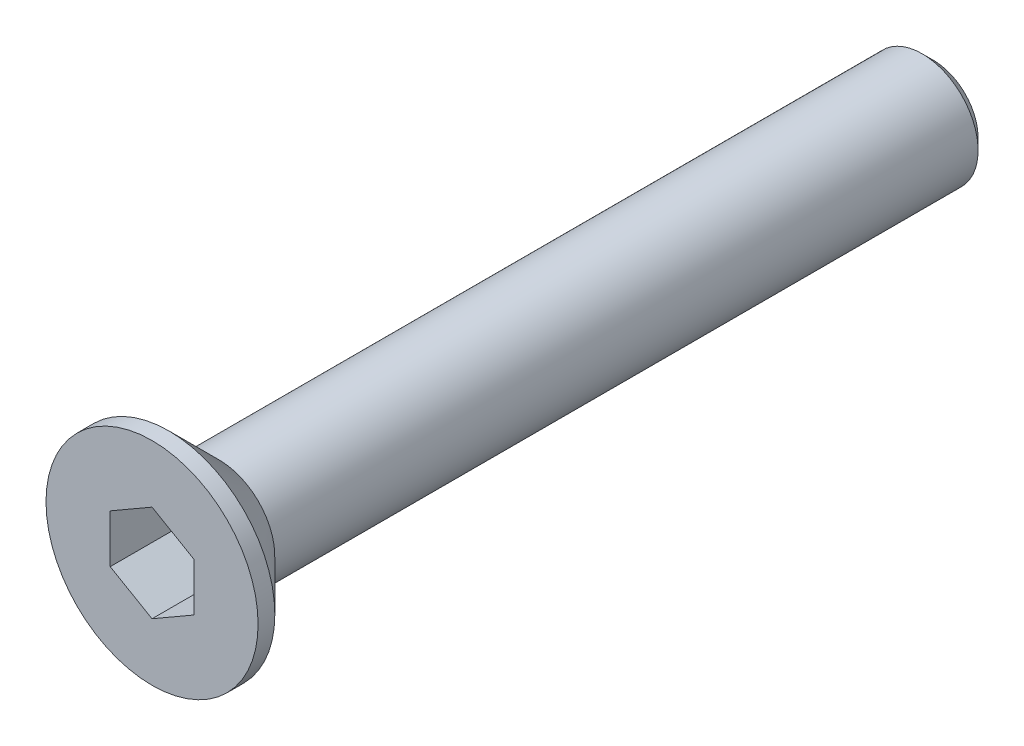
from build123d import *

# Parameters (mm, degrees)
CUT_EXTRUDE_1_DEPTH = 1.5
CHAMFER_1_SIZE      = 0.2


with BuildPart() as part:
    # 草图1 → 旋转1 (revolve)
    with BuildSketch(Plane(origin=(0, 0, 0), x_dir=(0, 0, -1), z_dir=(1, 0, 0)), mode=Mode.PRIVATE) as revolve_1_sk:
        Polygon((7, 0), (-7, 0), (-7, 1.9), (-6.7, 1.9), (-5.8, 1), (7, 1), align=None)
    revolve(revolve_1_sk.sketch.rotate(Axis((0, 0, -7), (0, 0, 1)), 90), axis=Axis((0, 0, -7), (0, 0, 1)))

    # 草图2 → 切除-拉伸1 (cut)
    with BuildSketch(Plane.XY.offset(7)):
        Polygon((0, 0.866025404), (-0.75, 0.433012702), (-0.75, -0.433012702), (0, -0.866025404), (0.75, -0.433012702), (0.75, 0.433012702), align=None)
    extrude(amount=-CUT_EXTRUDE_1_DEPTH, mode=Mode.SUBTRACT)

    # 倒角1
    chamfer_1_edges = [part.edges().sort_by_distance(p)[0] for p in [
        (1, 0, -7),
    ]]
    chamfer(chamfer_1_edges, length=CHAMFER_1_SIZE)


solid = part.part
